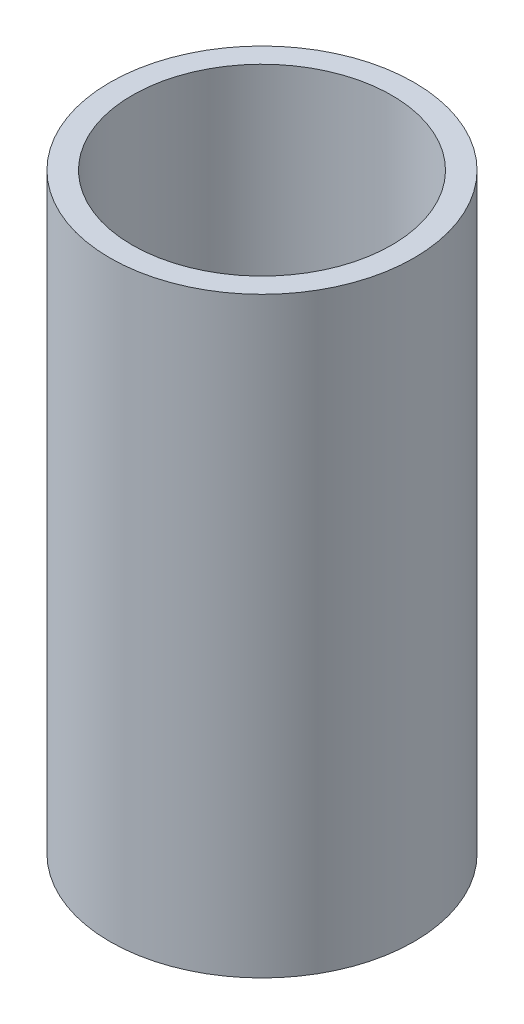
from build123d import *

# Parameters (mm, degrees)
SKETCH1_R           = 9.375
SKETCH1_R_2         = 8
EXTRUDE_THIN1_DEPTH = 36.5


with BuildPart() as part:
    # Sketch1 → Extrude-Thin1 (new body)
    with BuildSketch(Plane(origin=(0, 0, 0), x_dir=(1, 0, 0), z_dir=(0, 1, 0))):
        Circle(SKETCH1_R)
        Circle(SKETCH1_R_2, mode=Mode.SUBTRACT)
    extrude(amount=EXTRUDE_THIN1_DEPTH)


solid = part.part
